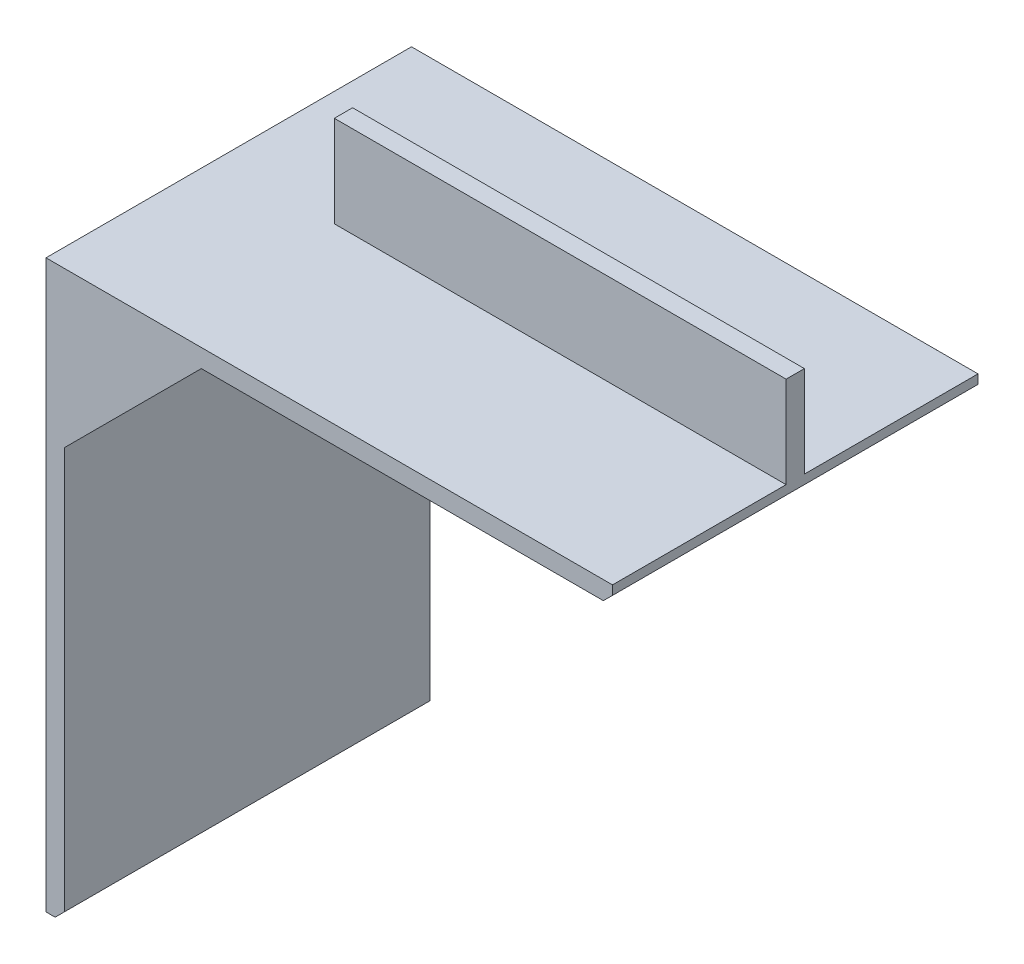
from build123d import *

# Parameters (mm, degrees)
BOSS_EXTRUDE1_DEPTH = 40
BOSS_EXTRUDE2_DEPTH = 3
LPATTERN1_COUNT     = 2
LPATTERN1_PITCH     = 37
CHAMFER1_SIZE       = 1
BOSS_EXTRUDE5_START = -21
SKETCH6_W           = 10
SKETCH6_H           = 49.445125494
SKETCH6_W_2         = 49.445125494
SKETCH6_H_2         = 10
BOSS_EXTRUDE5_DEPTH = 2


with BuildPart() as part:
    # Sketch2 → Boss-Extrude1 (new body)
    with BuildSketch(Plane.XY):
        Polygon((0, 0), (60, 0), (60, 2), (-2, 2), (-2, -60), (0, -60), align=None)
    extrude(amount=BOSS_EXTRUDE1_DEPTH)

    # Sketch3 → Boss-Extrude2 (add)
    with BuildSketch(Plane.XY.offset(40)):
        Polygon((15, 0), (0, 0), (0, -15), align=None)
    boss_extrude2 = extrude(amount=-BOSS_EXTRUDE2_DEPTH)

    # LPattern1: Boss-Extrude2 ×2
    with Locations(*[(0, 0, -i * LPATTERN1_PITCH) for i in range(1, LPATTERN1_COUNT)]):
        add(boss_extrude2)

    # Chamfer1
    chamfer1_edges = [part.edges().sort_by_distance(p)[0] for p in [
        (0, -60, 20),
        (60, 0, 20),
    ]]
    chamfer(chamfer1_edges, length=CHAMFER1_SIZE)

    # Sketch6 → Boss-Extrude5 (add)
    with BuildSketch(Plane.XY.offset(40).offset(BOSS_EXTRUDE5_START)):
        with Locations((-7, -35.277437253)):
            Rectangle(SKETCH6_W, SKETCH6_H)
        with Locations((35.277437253, 7)):
            Rectangle(SKETCH6_W_2, SKETCH6_H_2)
    extrude(amount=BOSS_EXTRUDE5_DEPTH)


solid = part.part
